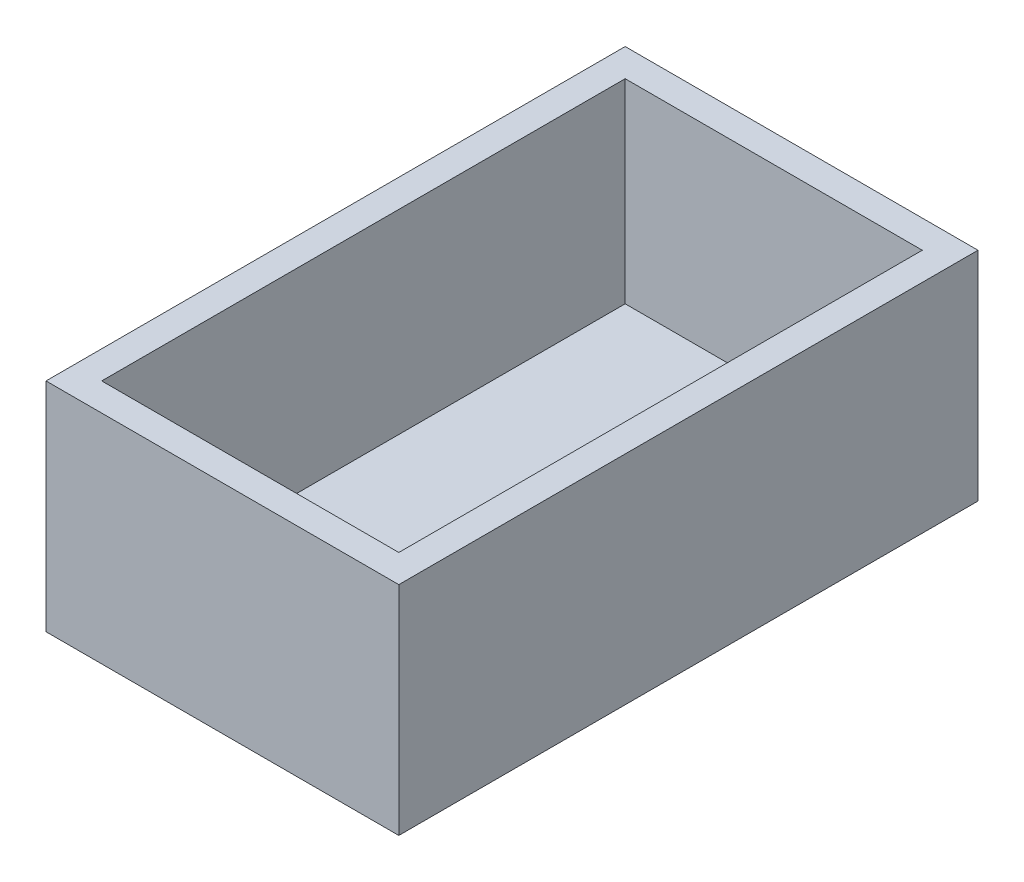
from build123d import *

# Parameters (mm, degrees)
SCHIZZO1_W                   = 63.34
SCHIZZO1_H                   = 103.98
ESTRUSIONE_ESTRUSIONE1_DEPTH = 4
SCHIZZO2_W                   = 63.34
SCHIZZO2_H                   = 103.98
SCHIZZO2_W_2                 = 53.34
SCHIZZO2_H_2                 = 93.98
ESTRUSIONE_ESTRUSIONE2_DEPTH = 35


with BuildPart() as part:
    # Schizzo1 → Estrusione-Estrusione1 (new body)
    with BuildSketch(Plane(origin=(0, 0, 0), x_dir=(1, 0, 0), z_dir=(0, 1, 0))):
        with Locations((31.67, 51.99)):
            Rectangle(SCHIZZO1_W, SCHIZZO1_H)
    extrude(amount=ESTRUSIONE_ESTRUSIONE1_DEPTH)

    # Schizzo2 → Estrusione-Estrusione2 (add)
    with BuildSketch(Plane(origin=(0, 4, 0), x_dir=(1, 0, 0), z_dir=(0, 1, 0))):
        with Locations((31.67, 51.99)):
            Rectangle(SCHIZZO2_W, SCHIZZO2_H)
        with Locations((31.67, 51.99)):
            Rectangle(SCHIZZO2_W_2, SCHIZZO2_H_2, mode=Mode.SUBTRACT)
    extrude(amount=ESTRUSIONE_ESTRUSIONE2_DEPTH)


solid = part.part
